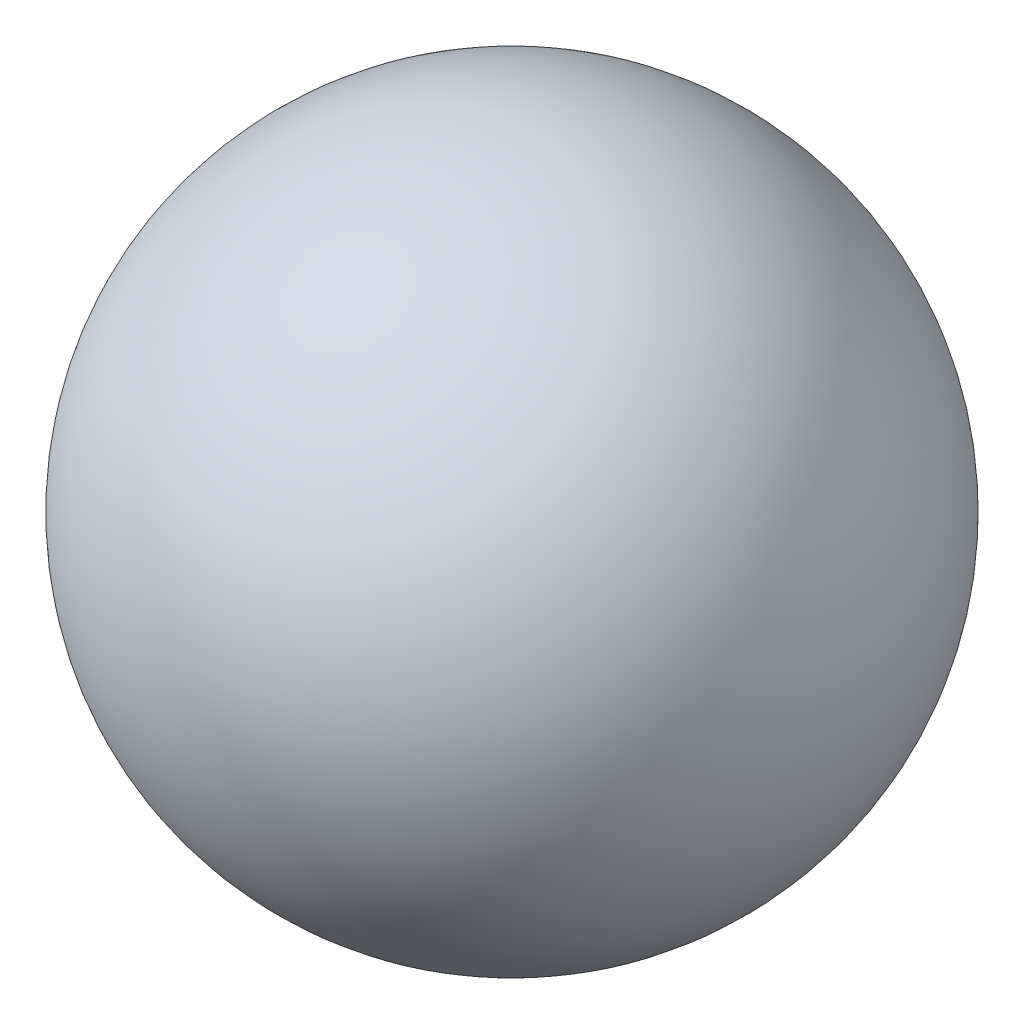
from build123d import *


with BuildPart() as part:
    # Sketch1 one side → Revolve2 (revolve)
    with BuildSketch(Plane.XY):
        with BuildLine():
            Line((0, -21.5), (0, 21.5))
            ThreePointArc((0, 21.5), (-21.5, 0), (0, -21.5))
        make_face()
    revolve(axis=Axis((0, 0, 0), (0, 1, 0)))


solid = part.part
